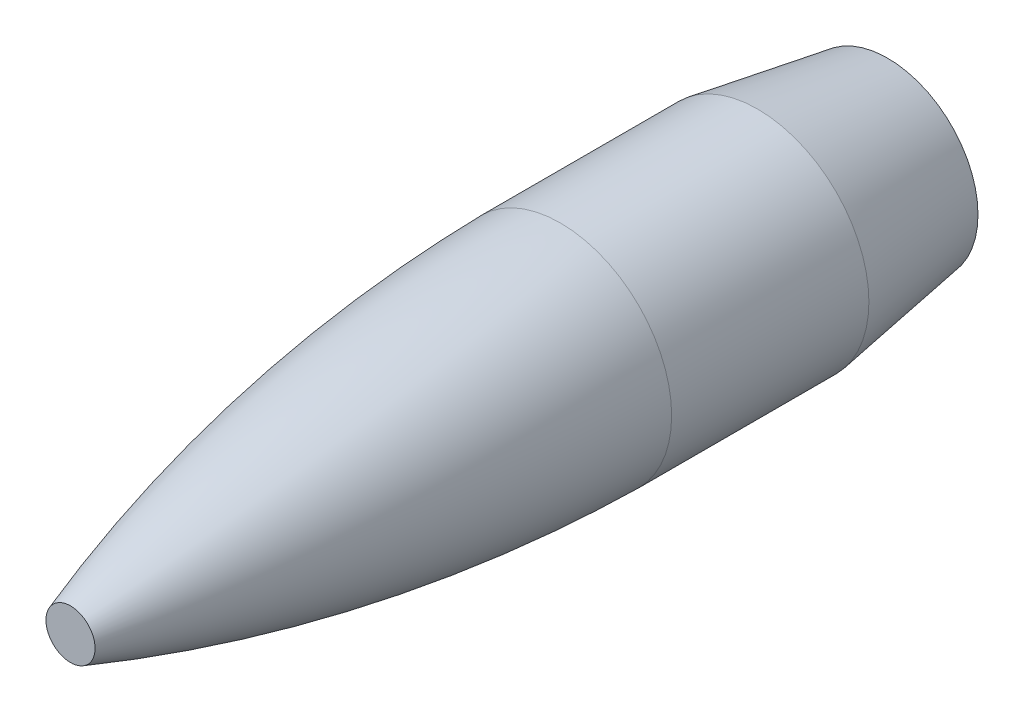
from build123d import *


with BuildPart() as part:
    # .308 Winchester → Revolve2 (revolve)
    with BuildSketch(Plane(origin=(0, 0, 0), x_dir=(1, 0, 0), z_dir=(0, 1, 0))):
        with BuildLine():
            Line((3.9116, -4.572), (3.175, 0))
            Line((3.175, 0), (0, 0))
            Line((0, 0), (0, -28.7274))
            Line((0, -28.7274), (0.8636, -28.7274))
            ThreePointArc((0.8636, -28.7274), (3.079506682, -20.23926136), (3.9116, -11.5062))
            Line((3.9116, -11.5062), (3.9116, -4.572))
        make_face()
    revolve(axis=Axis((0, 0, 28.7274), (0, 0, -1)))


solid = part.part
